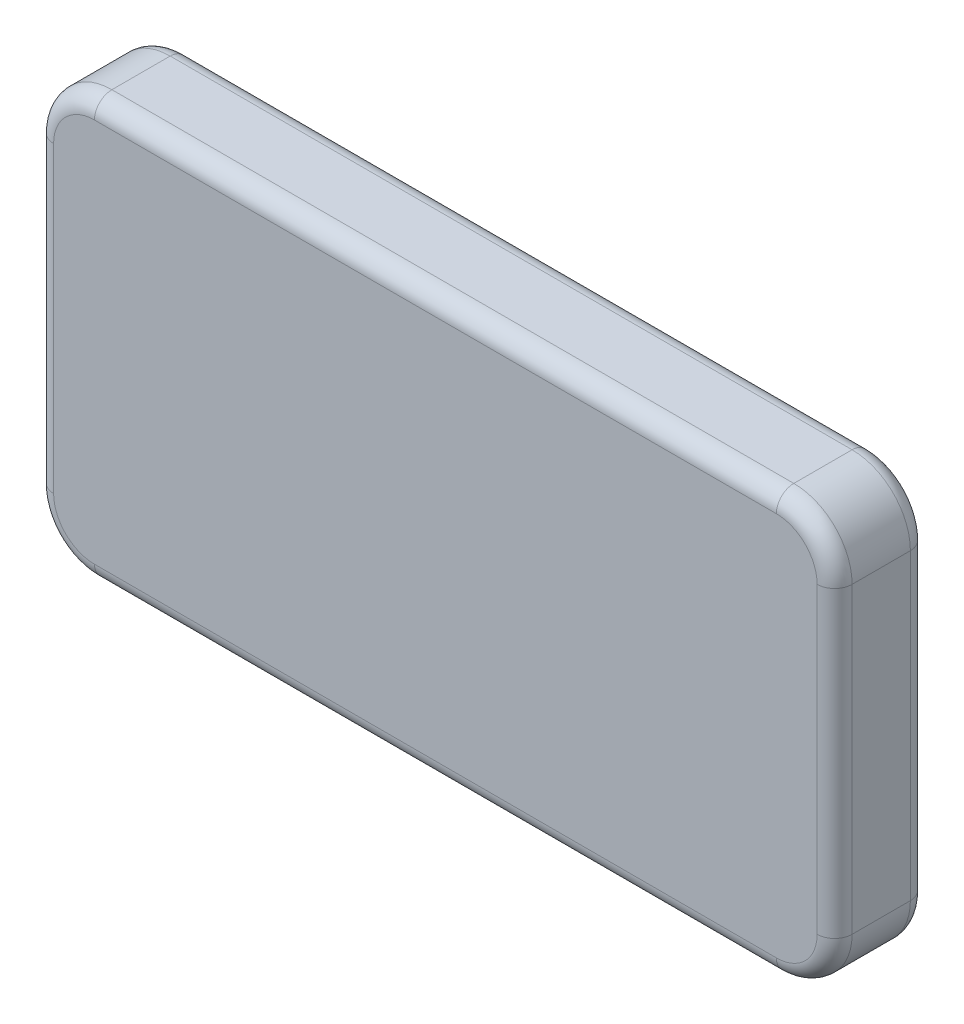
from build123d import *

# Parameters (mm, degrees)
SKETCH1_W           = 137
SKETCH1_H           = 72
BOSS_EXTRUDE1_DEPTH = 16
SKETCH2_W           = 5
SKETCH2_H           = 12.5
CUT_EXTRUDE1_DEPTH  = 12
FILLET1_R           = 10
FILLET2_R           = 3
FILLET3_R           = 3


with BuildPart() as part:
    # Sketch1 → Boss-Extrude1 (new body)
    with BuildSketch(Plane.XY):
        with Locations((-68.5, 36)):
            Rectangle(SKETCH1_W, SKETCH1_H)
    extrude(amount=BOSS_EXTRUDE1_DEPTH)

    # Sketch2 → Cut-Extrude1 (cut)
    with BuildSketch(Plane.ZY.offset(137)):
        with Locations((8, 52.75)):
            Rectangle(SKETCH2_W, SKETCH2_H)
        with Locations((8, 19.25)):
            Rectangle(SKETCH2_W, SKETCH2_H)
    extrude(amount=-CUT_EXTRUDE1_DEPTH, mode=Mode.SUBTRACT)

    # Fillet1
    fillet1_edges = [part.edges().sort_by_distance(p)[0] for p in [
        (0, 0, 8),
        (-137, 0, 8),
        (-137, 72, 8),
        (0, 72, 8),
    ]]
    fillet(fillet1_edges, radius=FILLET1_R)

    # Fillet2
    fillet2_edges = [part.edges().sort_by_distance(p)[0] for p in [
        (-68.5, 0, 0),
        (0, 36, 0),
        (-137, 36, 0),
        (-68.5, 72, 0),
        (-134.071067812, 69.071067812, 0),
        (-2.928932188, 69.071067812, 0),
        (-2.928932188, 2.928932188, 0),
        (-134.071067812, 2.928932188, 0),
    ]]
    fillet(fillet2_edges, radius=FILLET2_R)

    # Fillet3
    fillet3_edges = [part.edges().sort_by_distance(p)[0] for p in [
        (-68.5, 0, 16),
        (-137, 36, 16),
        (0, 36, 16),
        (-68.5, 72, 16),
        (-134.071067812, 69.071067812, 16),
        (-2.928932188, 69.071067812, 16),
        (-2.928932188, 2.928932188, 16),
        (-134.071067812, 2.928932188, 16),
    ]]
    fillet(fillet3_edges, radius=FILLET3_R)


solid = part.part
